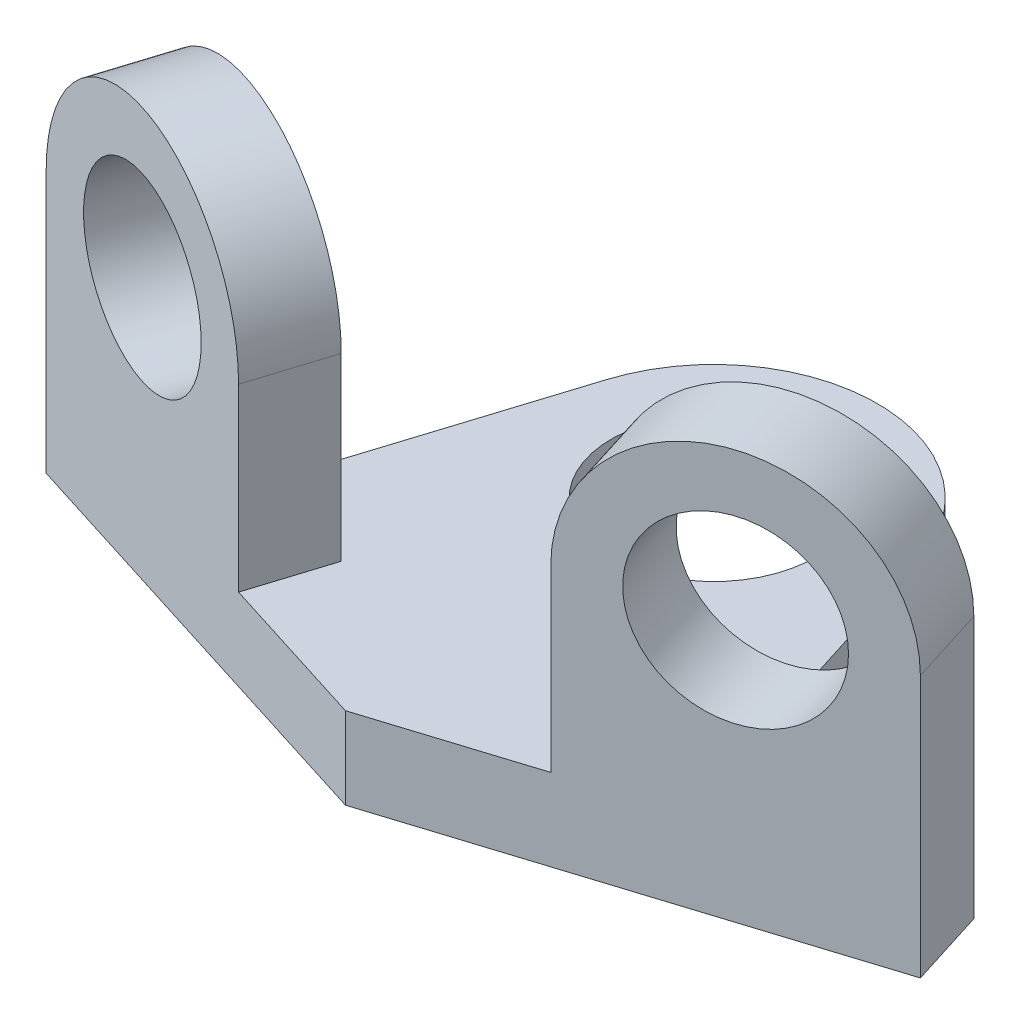
from build123d import *

# Parameters (mm, degrees)
BOSS_EXTRUDE1_DEPTH = 10
SKETCH2_R           = 18
SKETCH2_R_2         = 11
SKETCH2_W           = 36
SKETCH2_H           = 10
BOSS_EXTRUDE2_DEPTH = 10
SKETCH3_R           = 18
SKETCH3_R_2         = 11
SKETCH3_W           = 36
SKETCH3_H           = 10
BOSS_EXTRUDE3_DEPTH = 10


with BuildPart() as part:
    # Sketch1 → Boss-Extrude1 (new body)
    with BuildSketch(Plane(origin=(0, 0, 0), x_dir=(1, 0, 0), z_dir=(0, 1, 0))):
        with BuildLine():
            ThreePointArc((-19.074339015, 51.01411599), (-16.128892085, 33.173807033), (0, 25))
            Line((0, 25), (0, 32.5))
            ThreePointArc((0, 32.5), (-12.5, 45), (0, 57.5))
            Line((0, 57.5), (0, 65))
            ThreePointArc((0, 65), (-11.826192967, 61.128892085), (-19.074339015, 51.01411599))
        make_face()
        with BuildLine():
            Line((0, 32.5), (0, 25))
            ThreePointArc((0, 25), (14.142135624, 30.857864376), (20, 45))
            ThreePointArc((20, 45), (19.767230209, 48.042467724), (19.074339015, 51.01411599))
            ThreePointArc((19.074339015, 51.01411599), (11.826192967, 61.128892085), (0, 65))
            Line((0, 65), (0, 57.5))
            ThreePointArc((0, 57.5), (8.838834765, 53.838834765), (12.5, 45))
            ThreePointArc((12.5, 45), (8.838834765, 36.161165235), (0, 32.5))
        make_face()
        with BuildLine():
            Line((-19.074339015, 6.01411599), (0, 0))
            Line((0, 0), (0, 25))
            ThreePointArc((0, 25), (-16.128892085, 33.173807033), (-19.074339015, 51.01411599))
            Line((-19.074339015, 51.01411599), (-28.972750838, 19.620364501))
            Line((-28.972750838, 19.620364501), (-16.06728102, 15.551285498))
            Line((-16.06728102, 15.551285498), (-19.074339015, 6.01411599))
        make_face()
        Polygon((-31.979808833, 10.083194994), (-19.074339015, 6.01411599), (-16.06728102, 15.551285498), (-28.972750838, 19.620364501), align=None)
        Polygon((-53.408149242, 16.839524772), (-31.979808833, 10.083194994), (-28.972750838, 19.620364501), (-50.401091247, 26.37669428), align=None)
        with BuildLine():
            Line((19.074339015, 6.01411599), (16.06728102, 15.551285498))
            Line((16.06728102, 15.551285498), (28.972750838, 19.620364501))
            Line((28.972750838, 19.620364501), (28.800589663, 20.166389987))
            Line((28.800589663, 20.166389987), (19.074339015, 51.01411599))
            ThreePointArc((19.074339015, 51.01411599), (19.767230209, 48.042467724), (20, 45))
            ThreePointArc((20, 45), (14.142135624, 30.857864376), (0, 25))
            Line((0, 25), (0, 0))
            Line((0, 0), (19.074339015, 6.01411599))
        make_face()
        Polygon((28.972750838, 19.620364501), (16.06728102, 15.551285498), (19.074339015, 6.01411599), (31.979808833, 10.083194994), align=None)
        Polygon((50.401091247, 26.37669428), (28.972750838, 19.620364501), (31.979808833, 10.083194994), (53.408149242, 16.839524772), align=None)
    extrude(amount=BOSS_EXTRUDE1_DEPTH)

    # Sketch2 → Boss-Extrude2 (add)
    # profile 1 of 3: a face of its own
    with BuildSketch(Plane(origin=(0, 0, 0), x_dir=(0.9537169507482269, 0, -0.3007057995042735), z_dir=(0.3007057995042735, 0, 0.9537169507482269))):
        with Locations((38, 32)):
            Circle(SKETCH2_R)
        with Locations((38, 32)):
            Circle(SKETCH2_R_2, mode=Mode.SUBTRACT)
    # profile 2 of 3: a face of its own
    with BuildSketch(Plane(origin=(0, 0, 0), x_dir=(0.9537169507482269, 0, -0.3007057995042735), z_dir=(0.3007057995042735, 0, 0.9537169507482269))):
        with BuildLine():
            Line((20, 10), (56, 10))
            Line((56, 10), (56, 32))
            ThreePointArc((56, 32), (38, 14), (20, 32))
            Line((20, 32), (20, 10))
        make_face()
    # profile 3 of 3: a face of its own
    with BuildSketch(Plane(origin=(0, 0, 0), x_dir=(0.9537169507482269, 0, -0.3007057995042735), z_dir=(0.3007057995042735, 0, 0.9537169507482269))):
        with Locations((38, 5)):
            Rectangle(SKETCH2_W, SKETCH2_H)
    extrude(amount=-BOSS_EXTRUDE2_DEPTH)

    # Sketch3 → Boss-Extrude3 (add)
    # profile 1 of 3: a face of its own
    with BuildSketch(Plane(origin=(0, 0, 0), x_dir=(0.9537169507482268, 0, 0.3007057995042736), z_dir=(-0.3007057995042736, 0, 0.9537169507482268))):
        with Locations((-38, 32)):
            Circle(SKETCH3_R)
        with Locations((-38, 32)):
            Circle(SKETCH3_R_2, mode=Mode.SUBTRACT)
    # profile 2 of 3: a face of its own
    with BuildSketch(Plane(origin=(0, 0, 0), x_dir=(0.9537169507482268, 0, 0.3007057995042736), z_dir=(-0.3007057995042736, 0, 0.9537169507482268))):
        with BuildLine():
            Line((-56, 32), (-56, 10))
            Line((-56, 10), (-20, 10))
            Line((-20, 10), (-20, 32))
            ThreePointArc((-20, 32), (-38, 14), (-56, 32))
        make_face()
    # profile 3 of 3: a face of its own
    with BuildSketch(Plane(origin=(0, 0, 0), x_dir=(0.9537169507482268, 0, 0.3007057995042736), z_dir=(-0.3007057995042736, 0, 0.9537169507482268))):
        with Locations((-38, 5)):
            Rectangle(SKETCH3_W, SKETCH3_H)
    extrude(amount=-BOSS_EXTRUDE3_DEPTH)


solid = part.part
